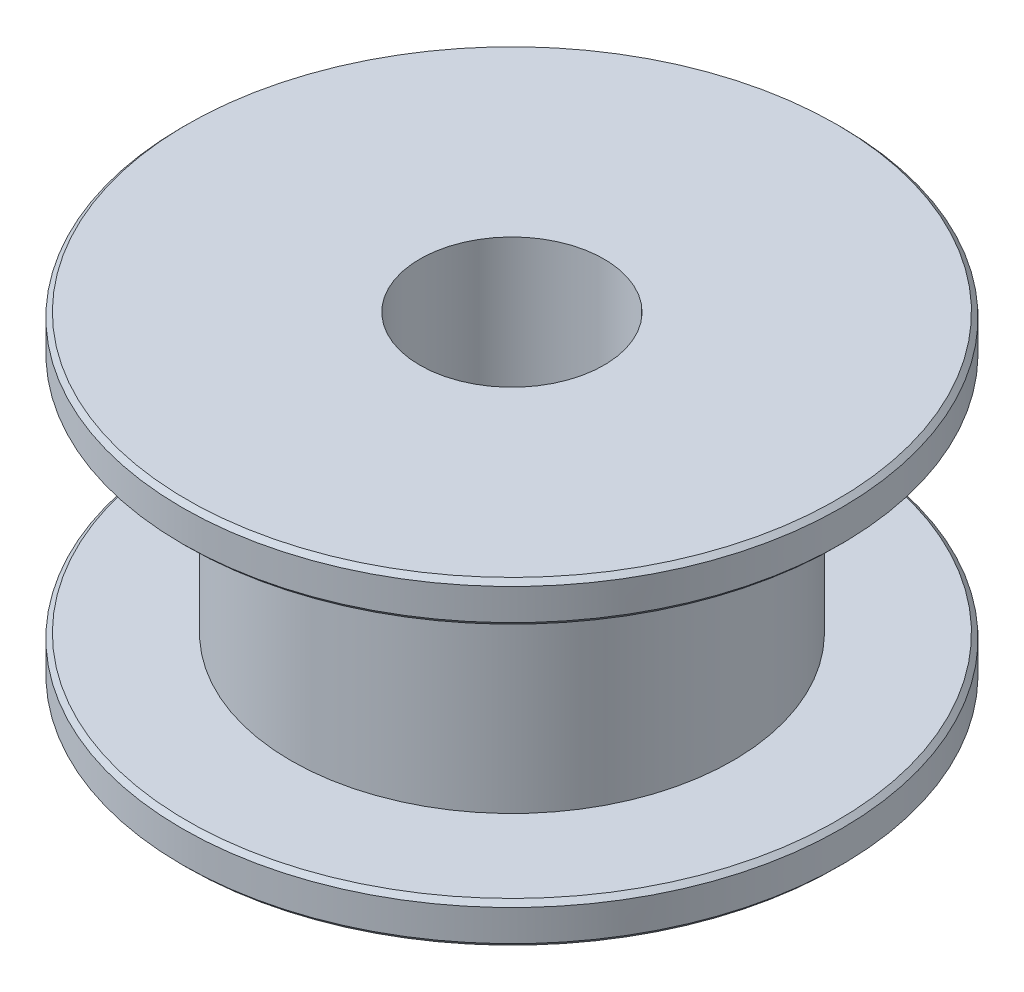
from build123d import *

# Parameters (mm, degrees)
CHAMFER1_SIZE = 0.125


with BuildPart() as part:
    # Sketch1 → Revolve1 (revolve)
    with BuildSketch(Plane.XY, mode=Mode.PRIVATE) as revolve1_sk:
        Polygon((2.5, 4.325), (2.5, -4.325), (8.95, -4.325), (8.95, -3.225), (6, -3.225), (6, 3.225), (8.95, 3.225), (8.95, 4.325), align=None)
    revolve(revolve1_sk.sketch.rotate(Axis((0, 55, 0), (0, -1, 0)), 90), axis=Axis((0, 55, 0), (0, -1, 0)))

    # Chamfer1
    chamfer1_edges = [part.edges().sort_by_distance(p)[0] for p in [
        (0, 4.325, -8.95),
        (0, 3.225, -8.95),
        (0, -3.225, -8.95),
        (0, -4.325, -8.95),
    ]]
    chamfer(chamfer1_edges, length=CHAMFER1_SIZE)


solid = part.part
